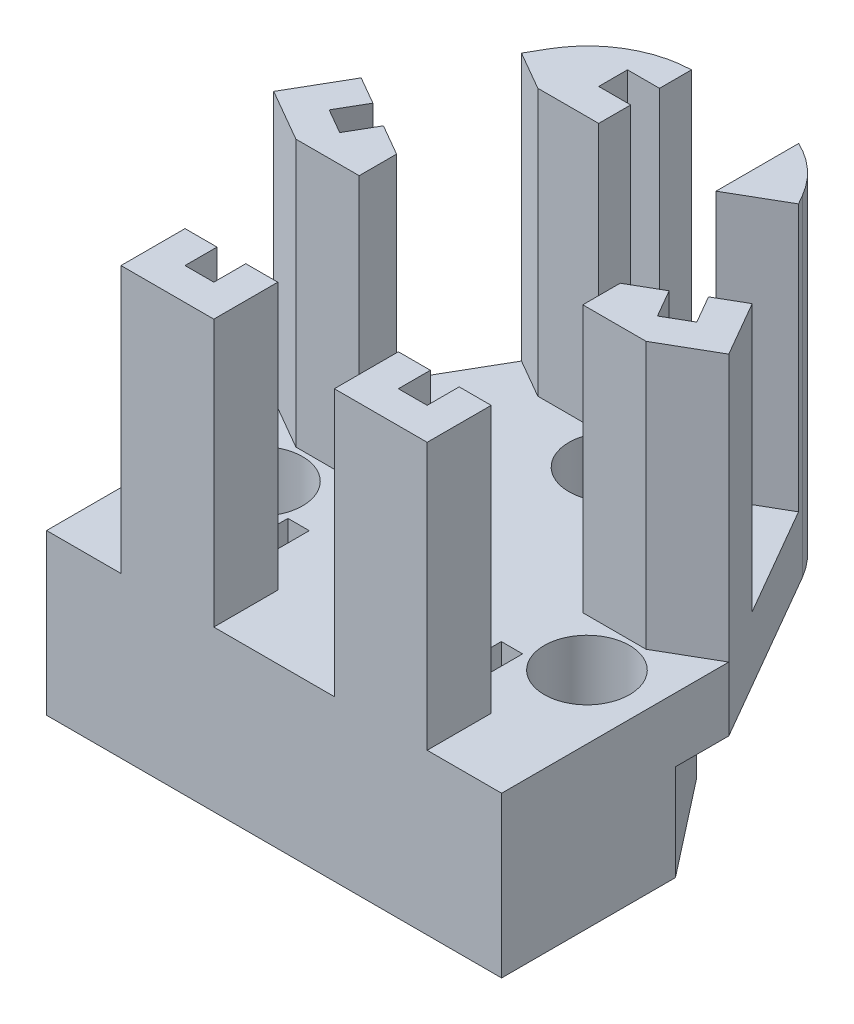
from build123d import *

# Parameters (mm, degrees)
BOSS_EXTRUDE1_DEPTH   = 25
BOSS_EXTRUDE1_2_DEPTH = 25
BOSS_EXTRUDE1_3_DEPTH = 25
BOSS_EXTRUDE1_4_DEPTH = 25
BOSS_EXTRUDE1_5_DEPTH = 25
BOSS_EXTRUDE1_6_DEPTH = 25
BOSS_EXTRUDE2_DEPTH   = 15
SKETCH3_R             = 1.5499999999999976
SKETCH3_R_2           = 1.5499999999999996
SKETCH3_R_3           = 1.5499999999999958
SKETCH3_W             = 5.4
SKETCH3_H             = 2
SKETCH3_W_2           = 2
SKETCH3_H_2           = 5.400000000000006
CUT_EXTRUDE1_DEPTH    = 51.449536703397406
SKETCH4_R             = 4.000000000000001
SKETCH4_R_2           = 4
SKETCH4_R_3           = 3.9999999999999973
CUT_EXTRUDE2_DEPTH    = 10
CUT_EXTRUDE12_DEPTH   = 9
SKETCH18_R            = 7.5
CUT_EXTRUDE13_DEPTH   = 3
FILLET1_R             = 10


with BuildPart() as part:
    # Sketch1 → Boss-Extrude1 (new body)
    with BuildSketch(Plane(origin=(0, 0, 0), x_dir=(1, 0, 0), z_dir=(0, 1, 0))):
        Polygon((-3.4999999999999987, -4.3500000000000005), (-9.208219674195641, -4.350000000000002), (-12.827870678242386, -2.260193518441092), (-9.011473670974864, 4.35), (-3.499999999999964, 4.35), (-3.4999999999999636, 1.35), (-6.499999999999999, 1.3499999999999996), (-6.499999999999999, -1.3500000000000005), (-3.4999999999999987, -1.3500000000000008), align=None)
    extrude(amount=BOSS_EXTRUDE1_DEPTH)



with BuildPart() as body_2:
    # Sketch1 → Boss-Extrude1 2 (new body)
    with BuildSketch(Plane(origin=(0, 0, 0), x_dir=(1, 0, 0), z_dir=(0, 1, 0))):
        Polygon((-21.327870678242448, -16.982625382776504), (-16.414613987909505, -19.81929545553799), (-10.481908744213749, -19.819295455538416), (-10.48190874421371, -16.31634119473297), (-13.391525876671139, -14.636472960069911), (-14.891525876671151, -17.23454917142322), (-16.06066017178014, -16.559549171423214), (-17.22979446688913, -15.884549171423206), (-15.729794466888796, -13.286472960069348), (-18.327870678242103, -11.786472960069336), align=None)
    extrude(amount=BOSS_EXTRUDE1_2_DEPTH)


with BuildPart() as body_3:
    # Sketch1 → Boss-Extrude1 3 (new body)
    with BuildSketch(Plane(origin=(0, 0, 0), x_dir=(1, 0, 0), z_dir=(0, 1, 0))):
        Polygon((9.011473670974846, 4.350000000000008), (7.500000000000001, 4.35), (7.500000000000003, -4.35), (12.400815759693463, -1.5205127018921853), align=None)
    extrude(amount=BOSS_EXTRUDE1_3_DEPTH)


with BuildPart() as body_4:
    # Sketch1 → Boss-Extrude1 4 (new body)
    with BuildSketch(Plane(origin=(0, 0, 0), x_dir=(1, 0, 0), z_dir=(0, 1, 0))):
        Polygon((21.3278706782425, -16.982625382776575), (16.4146139879095, -19.819295455537993), (10.481908744213753, -19.819295455538413), (10.481908744213746, -16.316341194733052), (13.391525876671182, -14.636472960069986), (14.891525876671192, -17.234549171423296), (16.060660171780043, -16.559549171423036), (17.22979446688917, -15.884549171423286), (15.729794466888857, -13.286472960069448), (18.32787067824215, -11.78647296006941), align=None)
    extrude(amount=BOSS_EXTRUDE1_4_DEPTH)


with BuildPart() as body_5:
    # Sketch1 → Boss-Extrude1 5 (new body)
    with BuildSketch(Plane(origin=(0, 0, 0), x_dir=(1, 0, 0), z_dir=(0, 1, 0))):
        Polygon((9.999999999999996, -35.27894572633552), (11.349999999999998, -35.27894572633552), (11.349999999999998, -32.27894572633372), (14.349999999999998, -32.27894572633372), (14.349999999999998, -38.27894572633372), (5.649999999999999, -38.27894572633372), (5.649999999999998, -32.27894572633428), (8.649999999999999, -32.27894572633428), (8.649999999999999, -35.27894572633552), align=None)
    extrude(amount=BOSS_EXTRUDE1_5_DEPTH)


with BuildPart() as body_6:
    # Sketch1 → Boss-Extrude1 6 (new body)
    with BuildSketch(Plane(origin=(0, 0, 0), x_dir=(1, 0, 0), z_dir=(0, 1, 0))):
        Polygon((-5.649999999999998, -32.27894572633428), (-5.649999999999999, -38.27894572633372), (-14.349999999999998, -38.27894572633372), (-14.349999999999998, -32.27894572633372), (-11.349999999999998, -32.27894572633372), (-11.349999999999998, -35.27894572633552), (-9.999999999999996, -35.27894572633552), (-8.649999999999999, -35.27894572633552), (-8.649999999999999, -32.27894572633428), align=None)
    extrude(amount=BOSS_EXTRUDE1_6_DEPTH)


with BuildPart() as part_1:
    add(part.part)

    add(body_2.part)  # Boss-Extrude2 merges body 2

    add(body_3.part)  # Boss-Extrude2 merges body 3

    add(body_4.part)  # Boss-Extrude2 merges body 4

    add(body_5.part)  # Boss-Extrude2 merges body 5

    add(body_6.part)  # Boss-Extrude2 merges body 6
    # Sketch2 → Boss-Extrude2 (add)
    with BuildSketch(Plane(origin=(0, 0, 0), x_dir=(-1, 0, 0), z_dir=(0, -1, 0))):
        Polygon((-21.3278706782425, -16.982625382776575), (-9.011473670974844, 4.350000000000008), (9.011473670974864, 4.35), (21.327870678242448, -16.982625382776515), (21.327870678242448, -38.27894572633375), (-21.3278706782425, -38.27894572633371), align=None)
    extrude(amount=BOSS_EXTRUDE2_DEPTH)

    # Sketch3 → Cut-Extrude1 (cut, through all)
    with BuildSketch(Plane(origin=(0, 0, 0), x_dir=(1, 0, 0), z_dir=(0, 1, 0))):
        with Locations(Location((-15.327870678242446, -24.278945726333717, 0), (0, 0, 270))):
            Circle(SKETCH3_R)
        with Locations(Location((1.55e-15, -6.649999999999997, 0), (0, 0, 270))):
            Circle(SKETCH3_R_2)
        with Locations(Location((15.327870678242453, -24.278945726333713, 0), (0, 0, 90))):
            Circle(SKETCH3_R_3)
        with Locations((0.10000000000000098, 0)):
            Rectangle(SKETCH3_W, SKETCH3_H)
        Polygon((-14.976685575564561, -12.682050096663907), (-13.244634767995688, -13.682050096663914), (-10.54463476799567, -9.005512916227953), (-12.276685575564542, -8.005512916227948), align=None)
        Polygon((11.000000000000004, -25.978945726335514), (9.000000000000004, -25.978945726335514), (9.000000000000007, -31.37894572633552), (11.000000000000007, -31.37894572633552), align=None)
        with Locations((-9.999999999999996, -28.678945726335517)):
            Rectangle(SKETCH3_W_2, SKETCH3_H_2)
        Polygon((10.544634767995705, -9.005512916227941), (12.27668557556458, -8.005512916227937), (14.976685575564584, -12.682050096663904), (13.244634767995707, -13.682050096663906), align=None)
    extrude(amount=-CUT_EXTRUDE1_DEPTH, mode=Mode.SUBTRACT)

    # Sketch4 → Cut-Extrude2 (cut)
    with BuildSketch(Plane(origin=(0, 0, 0), x_dir=(1, 0, 0), z_dir=(0, 1, 0))):
        with Locations(Location((-15.327870678242446, -24.278945726333717, 0), (0, 0, 270))):
            Circle(SKETCH4_R)
        with Locations(Location((1.55e-15, -6.649999999999996, 0), (0, 0, 270))):
            Circle(SKETCH4_R_2)
        with Locations(Location((15.327870678242453, -24.278945726333713, 0), (0, 0, 270))):
            Circle(SKETCH4_R_3)
    extrude(amount=-CUT_EXTRUDE2_DEPTH, mode=Mode.SUBTRACT)

    # Sketch17 → Cut-Extrude12 (cut)
    with BuildSketch(Plane(origin=(0, -15, 0), x_dir=(-1, 0, 0), z_dir=(0, -1, 0))):
        Polygon((7.011473670974844, -3.6499999999999915), (-7.011473670974842, -3.6499999999999932), (-21.32787067824244, -21.982625382776526), (-21.32787067824244, -16.982625382776508), (-9.011473670974846, 4.350000000000003), (9.011473670974864, 4.35), (21.327870678242448, -16.982625382776515), (21.327870678242448, -21.98262538277652), align=None)
    extrude(amount=-CUT_EXTRUDE12_DEPTH, mode=Mode.SUBTRACT)

    # Sketch18 → Cut-Extrude13 (cut)
    with BuildSketch(Plane(origin=(0, -15, 0), x_dir=(-1, 0, 0), z_dir=(0, -1, 0))):
        with Locations(Location((0, -17.650000000000002, 0), (0, 0, 90))):
            Circle(SKETCH18_R)
    extrude(amount=-CUT_EXTRUDE13_DEPTH, mode=Mode.SUBTRACT)

    # Fillet1
    fillet1_edges = [part_1.edges().sort_by_distance(p)[0] for p in [
        (-9.011473670974864, 9.5, -4.35),
        (9.011473670974846, 9.5, -4.350000000000008),
    ]]
    fillet(fillet1_edges, radius=FILLET1_R)


solid = part_1.part
